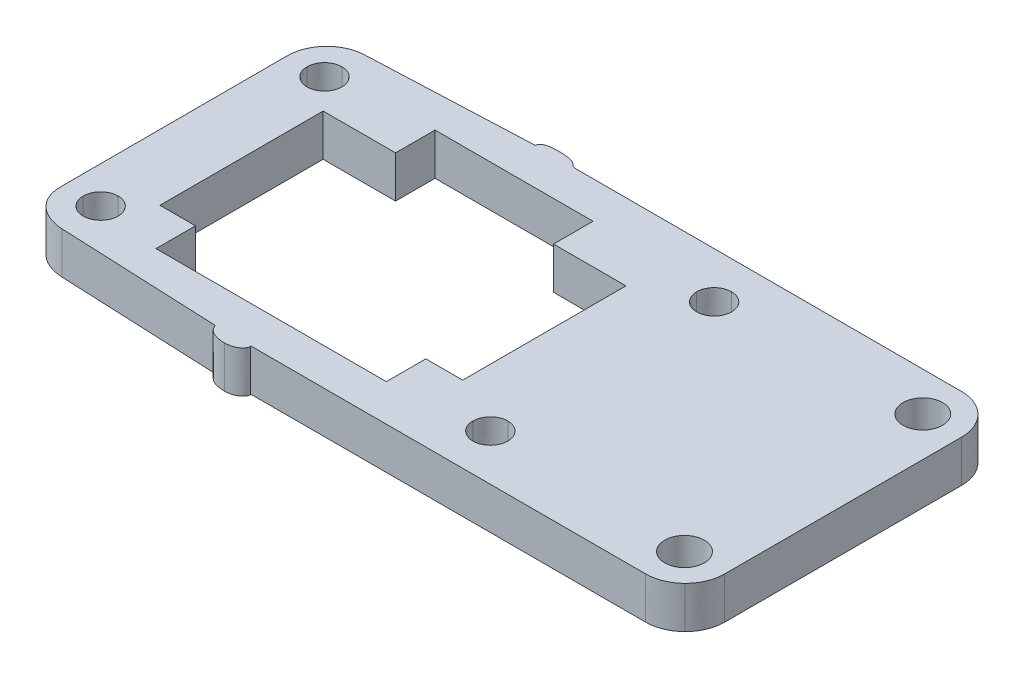
from build123d import *

# Parameters (mm, degrees)
SKETCH2_R           = 1.5001
SKETCH2_R_2         = 1.4999
BOSS_EXTRUDE1_DEPTH = 3.175


with BuildPart() as part:
    # Sketch2 → Boss-Extrude1 (new body)
    with BuildSketch(Plane(origin=(0, 0, 0), x_dir=(1, 0, 0), z_dir=(0, 1, 0))):
        with BuildLine():
            Line((97.281160584, 60.308737226), (127.310460584, 60.308737226))
            add(Edge.make_bspline(
                [(127.310460584, 60.308737226), (128.106060584, 60.308737226), (128.869060584, 60.624737226), (129.431660584, 61.187337226)],
                knots=[0.176470588, 0.176470588, 0.176470588, 0.176470588, 0.235294118, 0.235294118, 0.235294118, 0.235294118], degree=3))
            add(Edge.make_bspline(
                [(129.431660584, 61.187337226), (129.994260584, 61.749937226), (130.310460584, 62.513037226), (130.310460584, 63.308737226)],
                knots=[0.235294118, 0.235294118, 0.235294118, 0.235294118, 0.294117647, 0.294117647, 0.294117647, 0.294117647], degree=3))
            Line((130.310460584, 63.308737226), (130.310460584, 81.308637226))
            add(Edge.make_bspline(
                [(130.310460584, 81.308637226), (130.310460584, 82.104237226), (129.994260584, 82.867337226), (129.431660584, 83.429937226)],
                knots=[0.352941176, 0.352941176, 0.352941176, 0.352941176, 0.411764706, 0.411764706, 0.411764706, 0.411764706], degree=3))
            add(Edge.make_bspline(
                [(129.431660584, 83.429937226), (128.869060584, 83.992537226), (128.106060584, 84.308637226), (127.310460584, 84.308637226)],
                knots=[0.411764706, 0.411764706, 0.411764706, 0.411764706, 0.470588235, 0.470588235, 0.470588235, 0.470588235], degree=3))
            add(Edge.make_bspline(
                [(127.310460584, 84.308637226), (106.143660584, 84.308637226), (98.030760584, 84.308637226)],
                knots=[0.470588235, 0.470588235, 0.470588235, 0.529411765, 0.529411765, 0.529411765], degree=2))
            add(Edge.make_bspline(
                [(98.030760584, 84.308637226), (97.383160584, 84.308637226), (97.963460584, 84.812537226), (96.110460584, 84.812537226)],
                knots=[0.529411765, 0.529411765, 0.529411765, 0.529411765, 0.588235294, 0.588235294, 0.588235294, 0.588235294], degree=3))
            add(Edge.make_bspline(
                [(96.110460584, 84.812537226), (94.998360584, 84.812537226), (94.917760584, 84.308637226)],
                knots=[0.588235294, 0.588235294, 0.588235294, 0.647058824, 0.647058824, 0.647058824], degree=2))
            Line((94.917760584, 84.308637226), (82.453360584, 83.776237226))
            add(Edge.make_bspline(
                [(82.453360584, 83.776237226), (80.859760584, 83.692737226), (79.610460584, 82.376237226), (79.610460584, 80.780437226)],
                knots=[0.705882353, 0.705882353, 0.705882353, 0.705882353, 0.764705882, 0.764705882, 0.764705882, 0.764705882], degree=3))
            Line((79.610460584, 80.780437226), (79.624560584, 63.544537226))
            add(Edge.make_bspline(
                [(79.624560584, 63.544537226), (79.624560584, 61.948737226), (80.859760584, 60.924537226), (82.453360584, 60.841037226)],
                knots=[0.823529412, 0.823529412, 0.823529412, 0.823529412, 0.882352941, 0.882352941, 0.882352941, 0.882352941], degree=3))
            Line((82.453360584, 60.841037226), (94.626760584, 60.308737226))
            add(Edge.make_bspline(
                [(94.626760584, 60.308737226), (94.626860584, 60.308737226), (94.749560584, 59.512237226), (96.110460584, 59.512237226)],
                knots=[0, 0, 0, 0, 0.058823529, 0.058823529, 0.058823529, 0.058823529], degree=3))
            add(Edge.make_bspline(
                [(96.110460584, 59.512237226), (97.224360584, 59.512237226), (97.450360584, 60.308737226), (97.281160584, 60.308737226)],
                knots=[0.058823529, 0.058823529, 0.058823529, 0.058823529, 0.117647059, 0.117647059, 0.117647059, 0.117647059], degree=3))
        make_face()
        with Locations(Location((127.310460584, 81.358637226, 0), (0, 0, 270))):
            Circle(SKETCH2_R, mode=Mode.SUBTRACT)
        with Locations(Location((127.310460584, 63.258737226, 0), (0, 0, 270))):
            Circle(SKETCH2_R_2, mode=Mode.SUBTRACT)
        Polygon((104.860460584, 66.108737226), (104.810460584, 66.108737226), (104.810460584, 63.108737226), (87.310460584, 63.108737226), (87.310460584, 66.108737226), (84.610460584, 66.108737226), (84.610460584, 78.508637226), (90.110460584, 78.508637226), (90.110460584, 81.508637226), (102.110560584, 81.508637226), (102.110560584, 78.508637226), (107.610460584, 78.508637226), (107.610460584, 66.108737226), align=None, mode=Mode.SUBTRACT)
        with BuildLine():
            add(Edge.make_bspline(
                [(81.085360584, 63.808737226), (81.085360584, 63.076937226), (81.678660584, 62.483637226), (82.410260584, 62.483637226)],
                knots=[0, 0, 0, 0, 0.2, 0.2, 0.2, 0.2], degree=3))
            add(Edge.make_bspline(
                [(82.410260584, 62.483637226), (83.142160584, 62.483637226), (83.735360584, 63.076937226), (83.735360584, 63.808637226)],
                knots=[0.2, 0.2, 0.2, 0.2, 0.4, 0.4, 0.4, 0.4], degree=3))
            add(Edge.make_bspline(
                [(83.735360584, 63.808637226), (83.735360584, 64.540437226), (83.142160584, 65.133637226), (82.410460584, 65.133637226)],
                knots=[0.4, 0.4, 0.4, 0.4, 0.6, 0.6, 0.6, 0.6], degree=3))
            add(Edge.make_bspline(
                [(82.410460584, 65.133637226), (81.678660584, 65.133637226), (81.085360584, 64.540437226), (81.085360584, 63.808737226)],
                knots=[0.6, 0.6, 0.6, 0.6, 1, 1, 1, 1], degree=3))
        make_face(mode=Mode.SUBTRACT)
        with BuildLine():
            add(Edge.make_bspline(
                [(81.085360584, 80.808637226), (81.085360584, 80.076837226), (81.678660584, 79.483537226), (82.410260584, 79.483537226)],
                knots=[0, 0, 0, 0, 0.2, 0.2, 0.2, 0.2], degree=3))
            add(Edge.make_bspline(
                [(82.410260584, 79.483537226), (83.142160584, 79.483537226), (83.735360584, 80.076837226), (83.735360584, 80.808537226)],
                knots=[0.2, 0.2, 0.2, 0.2, 0.4, 0.4, 0.4, 0.4], degree=3))
            add(Edge.make_bspline(
                [(83.735360584, 80.808537226), (83.735360584, 81.540337226), (83.142160584, 82.133537226), (82.410460584, 82.133537226)],
                knots=[0.4, 0.4, 0.4, 0.4, 0.6, 0.6, 0.6, 0.6], degree=3))
            add(Edge.make_bspline(
                [(82.410460584, 82.133537226), (81.678660584, 82.133537226), (81.085360584, 81.540337226), (81.085360584, 80.808637226)],
                knots=[0.6, 0.6, 0.6, 0.6, 1, 1, 1, 1], degree=3))
        make_face(mode=Mode.SUBTRACT)
        with BuildLine():
            add(Edge.make_bspline(
                [(110.685260584, 63.808637226), (110.685260584, 63.076837226), (111.278560584, 62.483537226), (112.010160584, 62.483537226)],
                knots=[0, 0, 0, 0, 0.2, 0.2, 0.2, 0.2], degree=3))
            add(Edge.make_bspline(
                [(112.010160584, 62.483537226), (112.742060584, 62.483537226), (113.335260584, 63.076837226), (113.335260584, 63.808537226)],
                knots=[0.2, 0.2, 0.2, 0.2, 0.4, 0.4, 0.4, 0.4], degree=3))
            add(Edge.make_bspline(
                [(113.335260584, 63.808537226), (113.335260584, 64.540337226), (112.742060584, 65.133537226), (112.010360584, 65.133537226)],
                knots=[0.4, 0.4, 0.4, 0.4, 0.6, 0.6, 0.6, 0.6], degree=3))
            add(Edge.make_bspline(
                [(112.010360584, 65.133537226), (111.278560584, 65.133537226), (110.685260584, 64.540337226), (110.685260584, 63.808637226)],
                knots=[0.6, 0.6, 0.6, 0.6, 1, 1, 1, 1], degree=3))
        make_face(mode=Mode.SUBTRACT)
        with BuildLine():
            add(Edge.make_bspline(
                [(110.685260584, 80.808537226), (110.685260584, 80.076737226), (111.278560584, 79.483437226), (112.010160584, 79.483437226)],
                knots=[0, 0, 0, 0, 0.2, 0.2, 0.2, 0.2], degree=3))
            add(Edge.make_bspline(
                [(112.010160584, 79.483437226), (112.742060584, 79.483437226), (113.335260584, 80.076737226), (113.335260584, 80.808437226)],
                knots=[0.2, 0.2, 0.2, 0.2, 0.4, 0.4, 0.4, 0.4], degree=3))
            add(Edge.make_bspline(
                [(113.335260584, 80.808437226), (113.335260584, 81.540237226), (112.742060584, 82.133437226), (112.010360584, 82.133437226)],
                knots=[0.4, 0.4, 0.4, 0.4, 0.6, 0.6, 0.6, 0.6], degree=3))
            add(Edge.make_bspline(
                [(112.010360584, 82.133437226), (111.278560584, 82.133437226), (110.685260584, 81.540237226), (110.685260584, 80.808537226)],
                knots=[0.6, 0.6, 0.6, 0.6, 1, 1, 1, 1], degree=3))
        make_face(mode=Mode.SUBTRACT)
    extrude(amount=BOSS_EXTRUDE1_DEPTH)


solid = part.part
